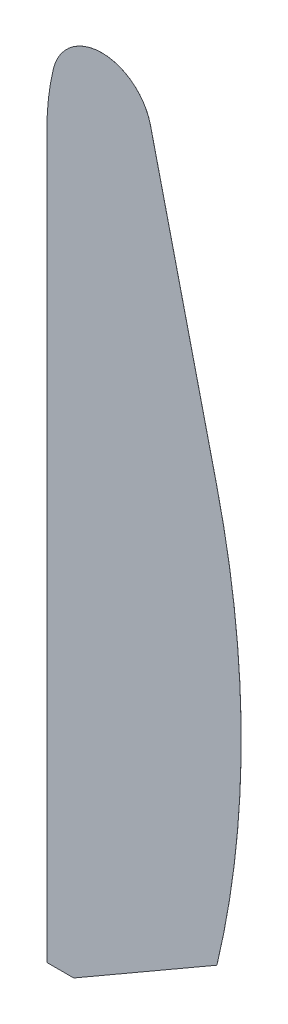
from build123d import *

# Parameters (mm, degrees)
BOSS_EXTRUDE1_DEPTH = 0.01


with BuildPart() as part:
    # Sketch1 → Boss-Extrude1 (new body)
    with BuildSketch(Plane(origin=(0, 0, 0), x_dir=(0, 1, 0), z_dir=(0, 0, 1))):
        with BuildLine():
            Line((0, 0), (134.85, 0))
            ThreePointArc((134.85, 0), (139.959706862, -0.29828361), (145, -1.189082355))
            ThreePointArc((145, -1.189082355), (152.161806716, -10.251582355), (145, -19.314082355))
            Line((145, -19.314082355), (92.783524319, -31.71875))
            ThreePointArc((92.783524319, -31.71875), (54.104800912, -36.25), (15.426077505, -31.71875))
            Line((15.426077505, -31.71875), (0, -5))
            Line((0, -5), (0, 0))
        make_face()
    extrude(amount=BOSS_EXTRUDE1_DEPTH)


solid = part.part
